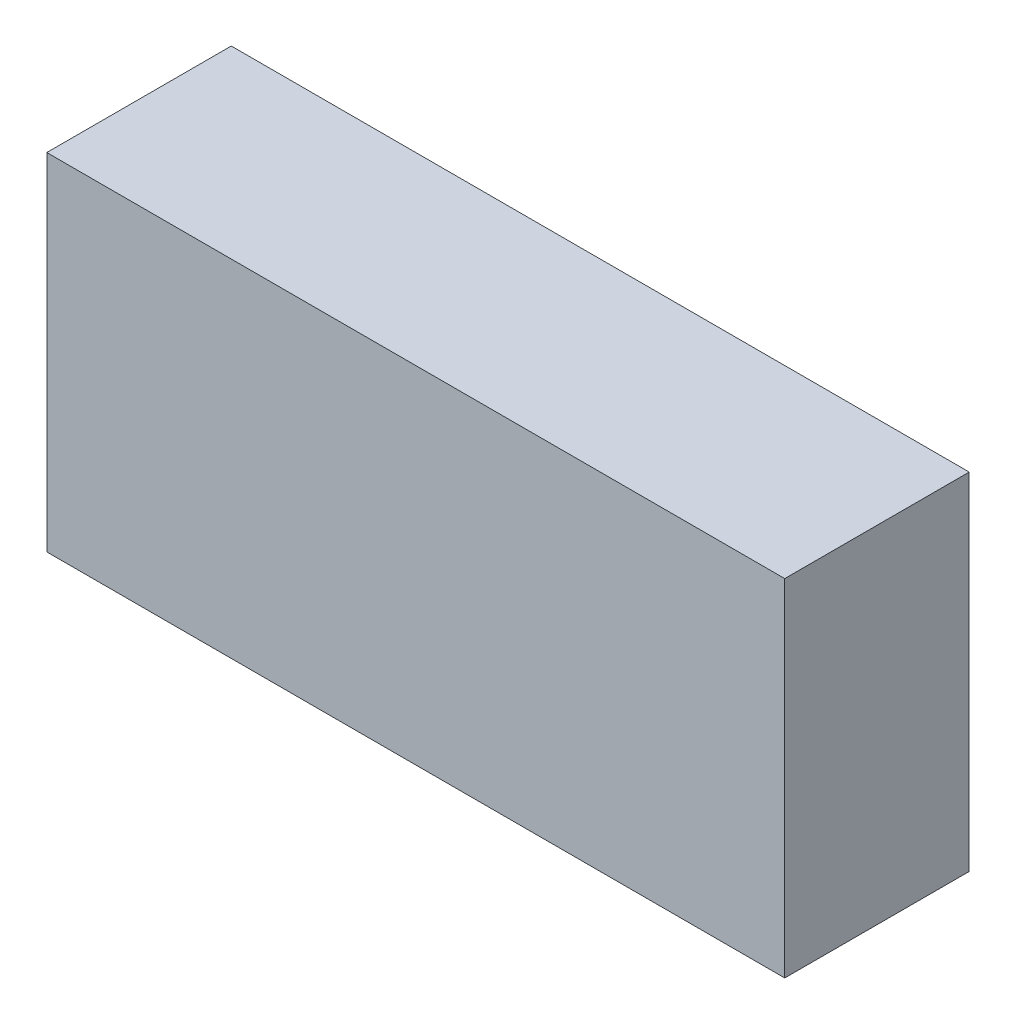
from build123d import *

# Parameters (mm, degrees)
SKETCH_1_W      = 64
SKETCH_1_H      = 30
EXTRUDE_1_DEPTH = 16


with BuildPart() as part:
    # 草图1 → 凸台-拉伸1 (new body)
    with BuildSketch(Plane.XY):
        Rectangle(SKETCH_1_W, SKETCH_1_H)
    extrude(amount=-EXTRUDE_1_DEPTH)


solid = part.part
